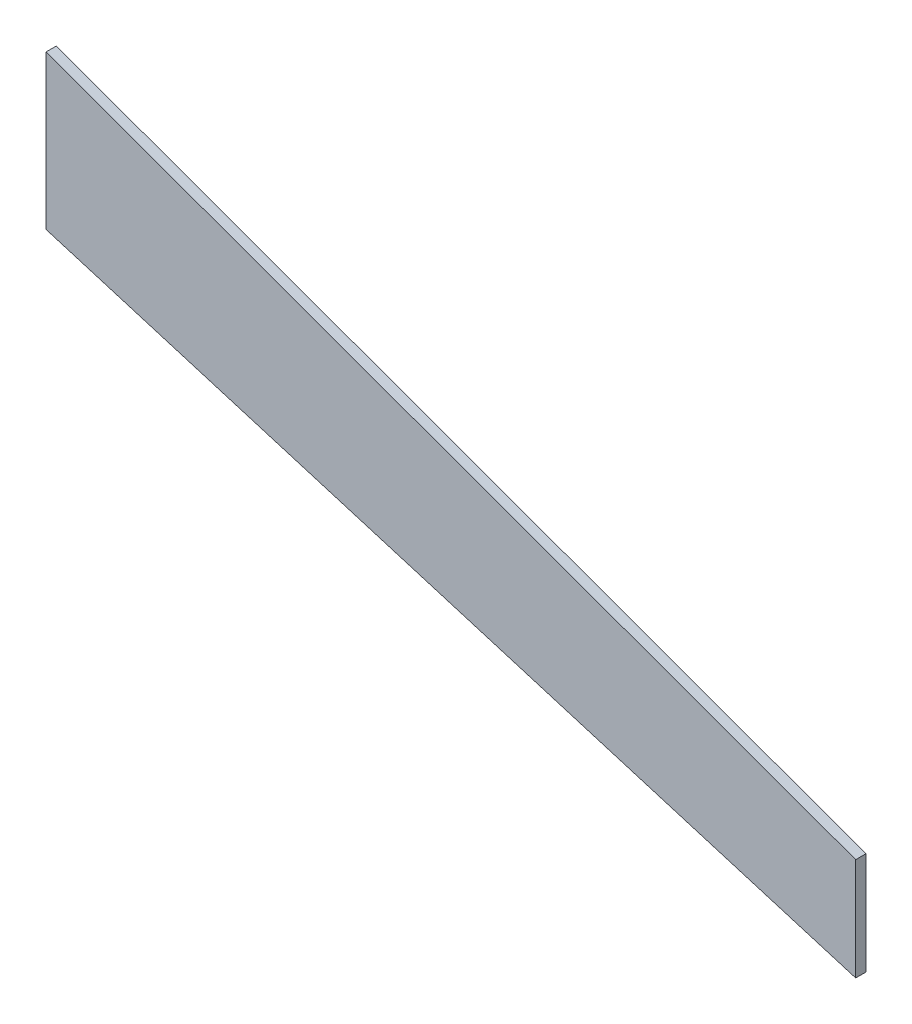
from build123d import *

# Parameters (mm, degrees)
BOSS_EXTRUDE1_DEPTH = 4


with BuildPart() as part:
    # Sketch1 → Boss-Extrude1 (new body)
    with BuildSketch(Plane.XY):
        Polygon((0, 60), (0, 0), (316, -95.014594028), (316, -55.014594028), align=None)
    extrude(amount=BOSS_EXTRUDE1_DEPTH)


solid = part.part
